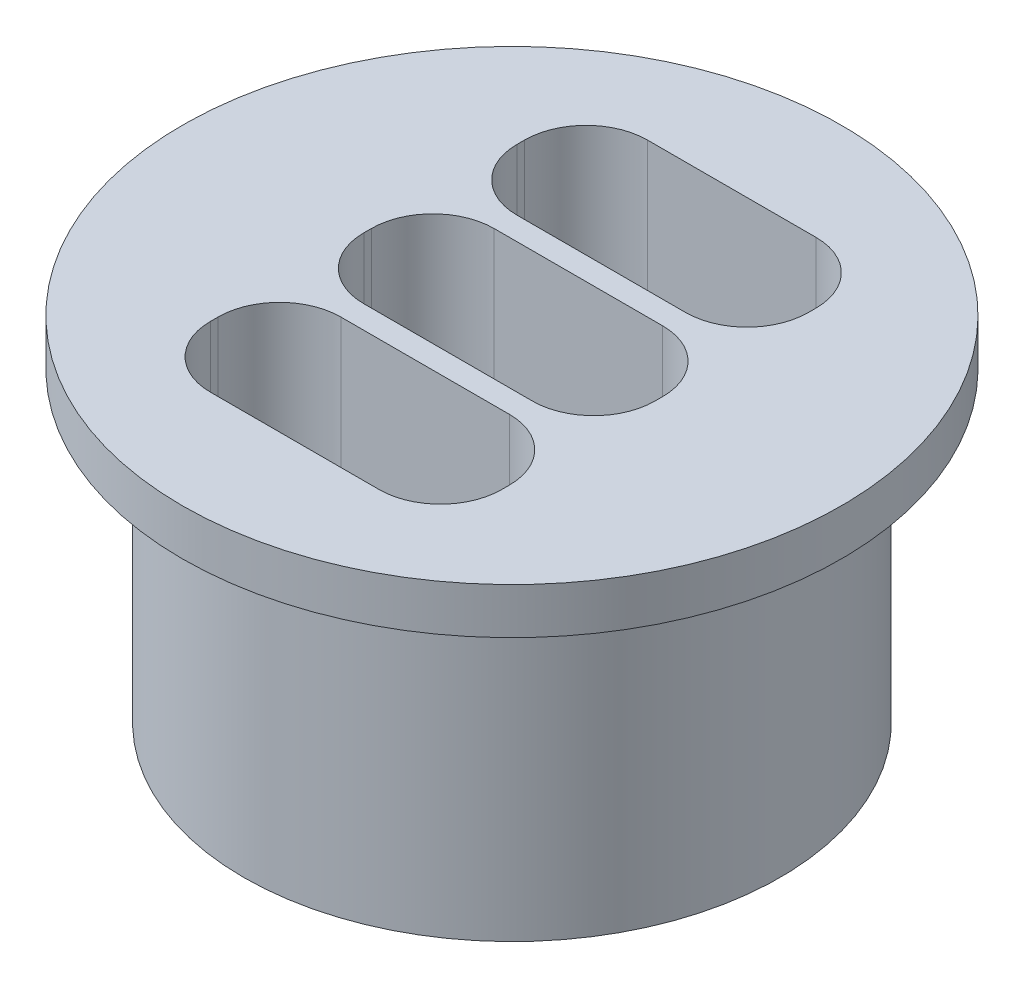
from build123d import *

# Parameters (mm, degrees)
SKETCH1_R           = 17.5
BOSS_EXTRUDE1_DEPTH = 20
SKETCH2_R           = 21.5
BOSS_EXTRUDE2_DEPTH = 3
SKETCH3_W           = 19
SKETCH3_H           = 8.5
CUT_EXTRUDE3_DEPTH  = 23
FILLET11_R          = 4
FILLET12_R          = 4


with BuildPart() as part:
    # Sketch1 → Boss-Extrude1 (new body)
    with BuildSketch(Plane(origin=(0, 0, 0), x_dir=(1, 0, 0), z_dir=(0, 1, 0))):
        with Locations(Location((0, 0, 0), (0, 0, 270))):
            Circle(SKETCH1_R)
    extrude(amount=BOSS_EXTRUDE1_DEPTH)

    # Sketch2 → Boss-Extrude2 (add)
    with BuildSketch(Plane(origin=(0, 20, 0), x_dir=(1, 0, 0), z_dir=(0, 1, 0))):
        with Locations(Location((0, 0, 0), (0, 0, 270))):
            Circle(SKETCH2_R)
    extrude(amount=BOSS_EXTRUDE2_DEPTH)

    # Sketch3 → Cut-Extrude3 (cut)
    with BuildSketch(Plane(origin=(0, 23, 0), x_dir=(1, 0, 0), z_dir=(0, 1, 0))):
        with Locations((0, 0.083811037)):
            Rectangle(SKETCH3_W, SKETCH3_H)
        with Locations((0, 10.083811037)):
            Rectangle(SKETCH3_W, SKETCH3_H)
        with Locations((0, -9.916188963)):
            Rectangle(SKETCH3_W, SKETCH3_H)
    extrude(amount=-CUT_EXTRUDE3_DEPTH, mode=Mode.SUBTRACT)

    # Fillet11
    fillet11_edges = [part.edges().sort_by_distance(p)[0] for p in [
        (9.5, 11.5, 4.166188963),
        (-9.5, 11.5, 4.166188963),
        (-9.5, 11.5, -4.333811037),
        (9.5, 11.5, -4.333811037),
        (9.5, 11.5, 14.166188963),
        (-9.5, 11.5, 14.166188963),
        (-9.5, 11.5, 5.666188963),
        (9.5, 11.5, 5.666188963),
    ]]
    fillet(fillet11_edges, radius=FILLET11_R)

    # Fillet12
    fillet12_edges = [part.edges().sort_by_distance(p)[0] for p in [
        (9.5, 11.5, -14.333811037),
        (9.5, 11.5, -5.833811037),
        (-9.5, 11.5, -5.833811037),
        (-9.5, 11.5, -14.333811037),
    ]]
    fillet(fillet12_edges, radius=FILLET12_R)


solid = part.part
